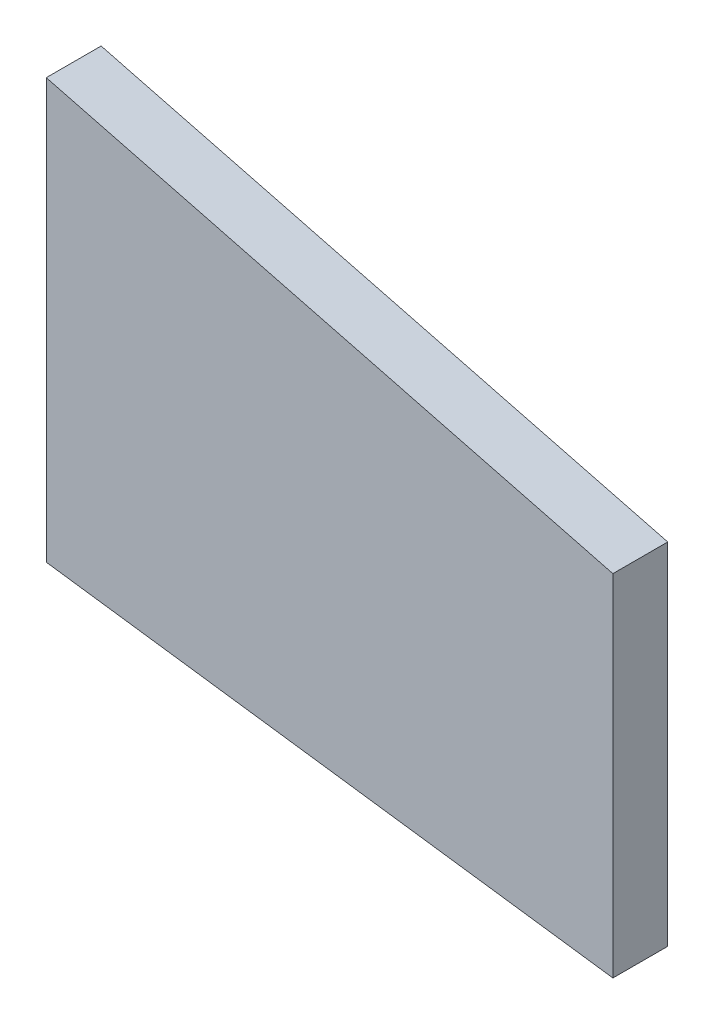
from build123d import *

# Parameters (mm, degrees)
BOSS_EXTRUDE1_DEPTH = 19.05
CUT_EXTRUDE2_DEPTH  = 781.686405159


with BuildPart() as part:
    # Sketch1 → Boss-Extrude1 (new body)
    with BuildSketch(Plane.XY):
        Polygon((0, 0), (196.85, 0), (196.85, 127), (0, 177.8), align=None)
    extrude(amount=BOSS_EXTRUDE1_DEPTH)

    # Sketch3 → Cut-Extrude2 (cut)
    with BuildSketch(Plane.XY.offset(19.05)):
        Polygon((0, 0), (0, 32.004), (196.85, 5.334), (196.85, 0), align=None)
    extrude(amount=-CUT_EXTRUDE2_DEPTH, mode=Mode.SUBTRACT)


solid = part.part
